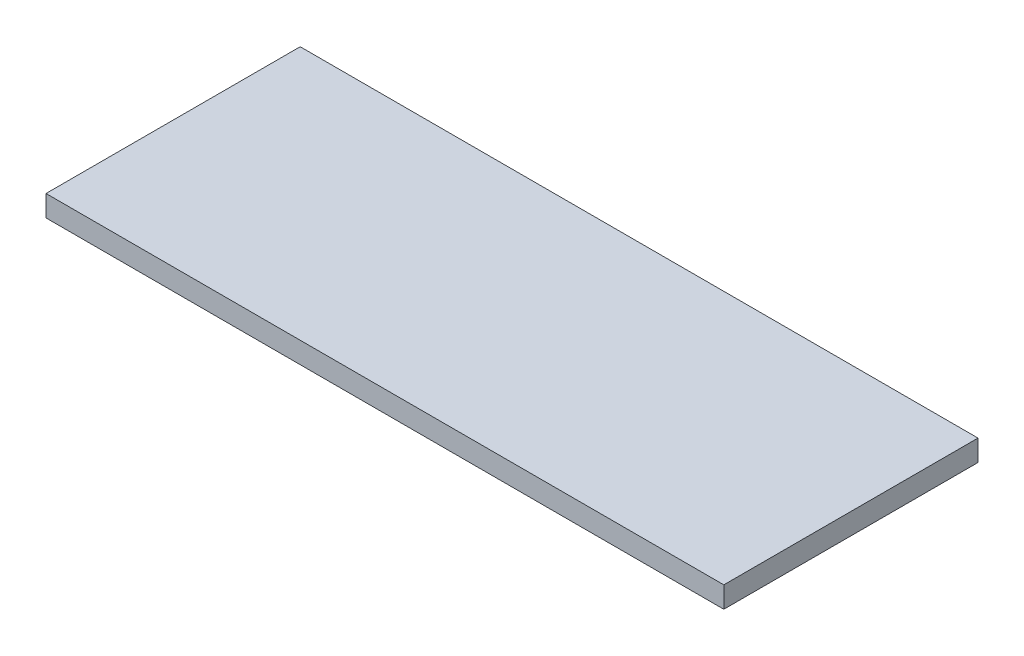
from build123d import *

# Parameters (mm, degrees)
SKETCH1_W           = 160
SKETCH1_H           = 60
BOSS_EXTRUDE1_DEPTH = 5


with BuildPart() as part:
    # Sketch1 → Boss-Extrude1 (new body)
    with BuildSketch(Plane(origin=(0, 0, 0), x_dir=(1, 0, 0), z_dir=(0, 1, 0))):
        Rectangle(SKETCH1_W, SKETCH1_H)
    extrude(amount=BOSS_EXTRUDE1_DEPTH)


solid = part.part
